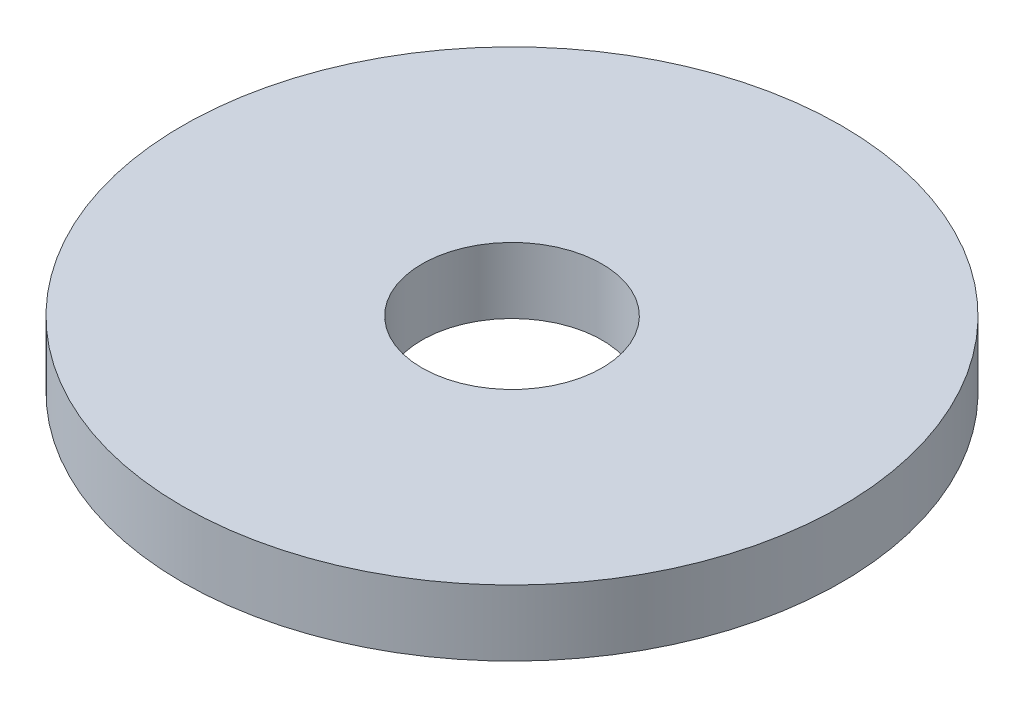
from build123d import *

# Parameters (mm, degrees)
SKETCH_1_R      = 15
SKETCH_1_R_2    = 4.1
EXTRUDE_1_DEPTH = 3


with BuildPart() as part:
    # 草图1 → 凸台-拉伸1 (new body)
    with BuildSketch(Plane(origin=(0, 0, 0), x_dir=(1, 0, 0), z_dir=(0, 1, 0))):
        with Locations(Location((0, 0, 0), (0, 0, 270))):
            Circle(SKETCH_1_R)
        with Locations(Location((0, 0, 0), (0, 0, 270))):
            Circle(SKETCH_1_R_2, mode=Mode.SUBTRACT)
    extrude(amount=EXTRUDE_1_DEPTH)


solid = part.part
